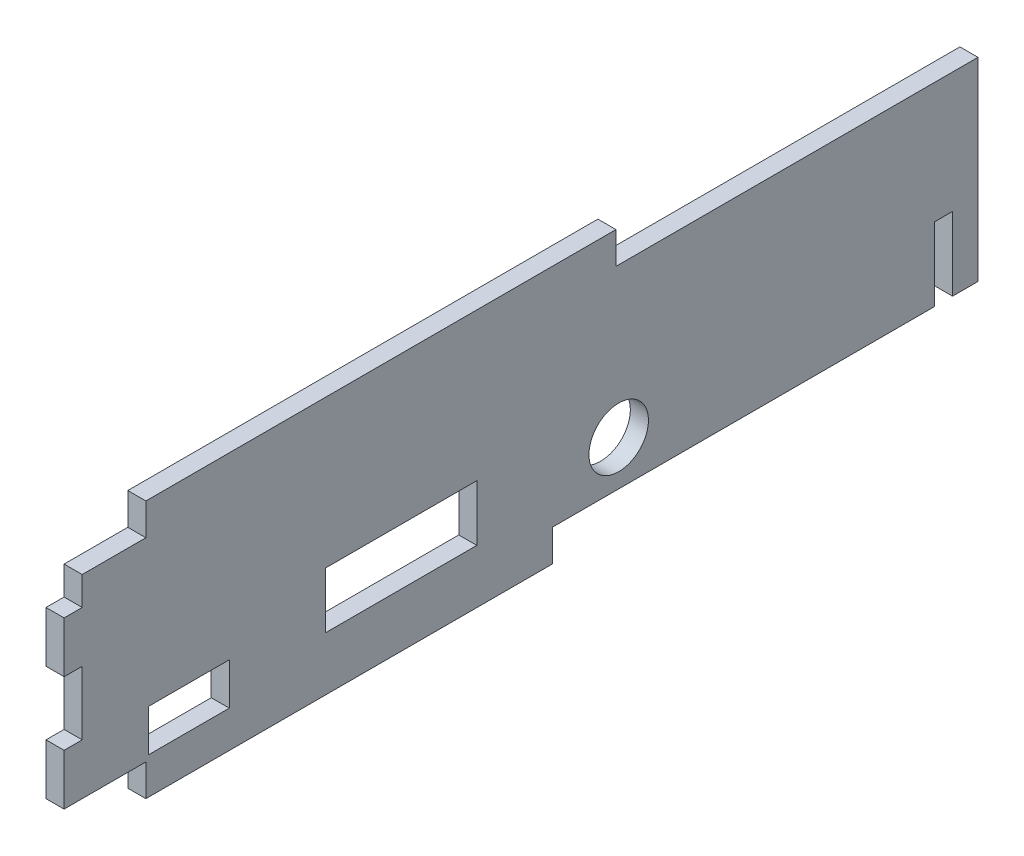
from build123d import *

# Parameters (mm, degrees)
SKETCH2_W           = 8.0391
SKETCH2_H           = 4.1783
SKETCH2_W_2         = 15.0876
SKETCH2_H_2         = 5.588
SKETCH2_R           = 2.96545
BOSS_EXTRUDE1_DEPTH = 1.8034


with BuildPart() as part:
    # Sketch2 → Boss-Extrude1 (new body)
    with BuildSketch(Plane(origin=(0, 0, 0), x_dir=(0, 0, -1), z_dir=(1, 0, 0))):
        Polygon((6.35, 24.0792), (0, 24.0792), (0, 21.2344), (-1.8034, 21.2344), (-1.8034, 16.1544), (0, 16.1544), (0, 9.8044), (-1.8034, 9.8044), (-1.8034, 4.7244), (6.35, 4.7244), (6.35, 1.5494), (46.863, 1.5494), (46.863, 4.7244), (84.963, 4.7244), (84.963, 12.0396), (86.7664, 12.0396), (86.7664, 4.7244), (89.3064, 4.7244), (89.3064, 24.0792), (53.213, 24.0792), (53.213, 27.2542), (6.35, 27.2542), align=None)
        with Locations((10.64895, 7.29615)):
            Rectangle(SKETCH2_W, SKETCH2_H, mode=Mode.SUBTRACT)
        with Locations((31.8008, 9.7155)):
            Rectangle(SKETCH2_W_2, SKETCH2_H_2, mode=Mode.SUBTRACT)
        with Locations((53.48605, 9.17575)):
            Circle(SKETCH2_R, mode=Mode.SUBTRACT)
    extrude(amount=BOSS_EXTRUDE1_DEPTH)


solid = part.part
